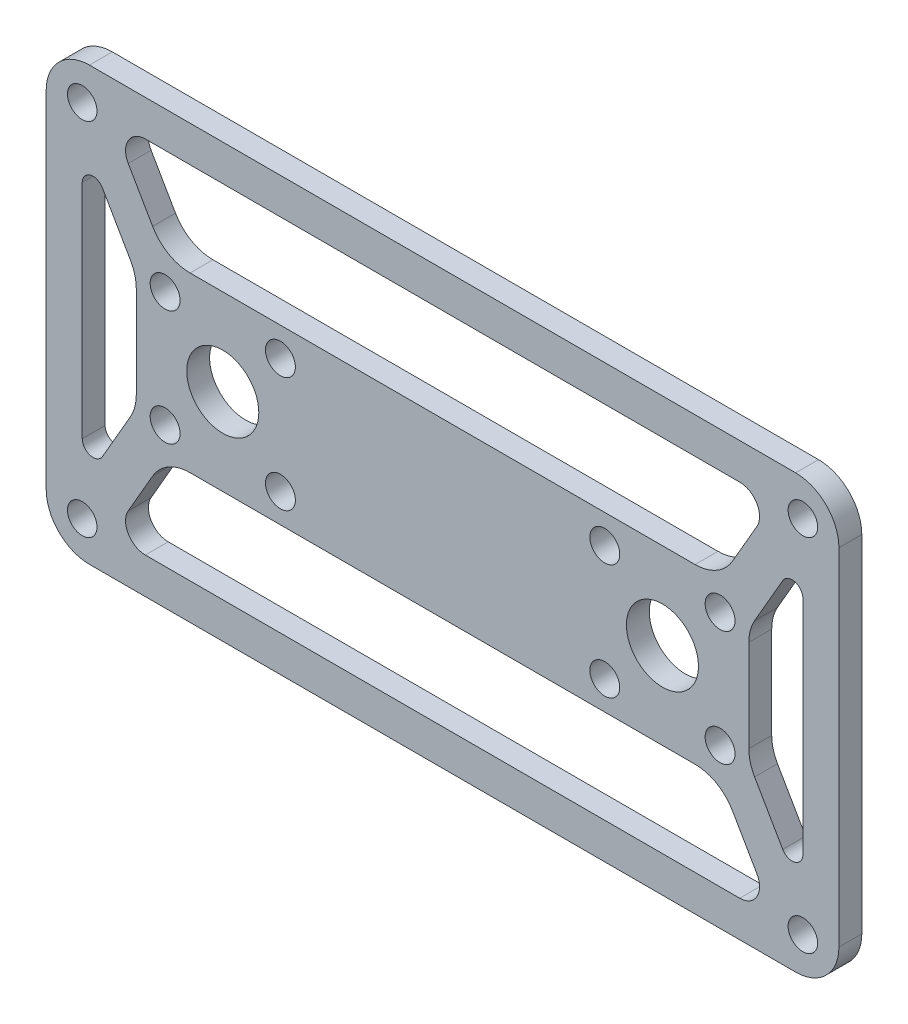
from build123d import *

# Parameters (mm, degrees)
SKETCH1_W           = 110
SKETCH1_H           = 60
SKETCH1_R           = 2.05
SKETCH1_R_2         = 2.075
SKETCH1_R_3         = 5
BOSS_EXTRUDE1_DEPTH = 3.175
FILLET1_R           = 6
FILLET2_R           = 2.75
FILLET3_R           = 1.5
FILLET4_R           = 6


with BuildPart() as part:
    # Sketch1 → Boss-Extrude1 (new body)
    with BuildSketch(Plane.XY):
        Rectangle(SKETCH1_W, SKETCH1_H)
        with Locations((-50, 25)):
            Circle(SKETCH1_R, mode=Mode.SUBTRACT)
        with Locations((50, 25)):
            Circle(SKETCH1_R, mode=Mode.SUBTRACT)
        with Locations((50, -25)):
            Circle(SKETCH1_R, mode=Mode.SUBTRACT)
        with Locations((-50, -25)):
            Circle(SKETCH1_R, mode=Mode.SUBTRACT)
        with Locations((-38.5, 8)):
            Circle(SKETCH1_R_2, mode=Mode.SUBTRACT)
        with Locations((-22.5, 8)):
            Circle(SKETCH1_R_2, mode=Mode.SUBTRACT)
        with Locations((-22.5, -8)):
            Circle(SKETCH1_R_2, mode=Mode.SUBTRACT)
        with Locations((-38.5, -8)):
            Circle(SKETCH1_R_2, mode=Mode.SUBTRACT)
        with Locations((22.51, 8)):
            Circle(SKETCH1_R_2, mode=Mode.SUBTRACT)
        with Locations((38.51, 8)):
            Circle(SKETCH1_R_2, mode=Mode.SUBTRACT)
        with Locations((38.51, -8)):
            Circle(SKETCH1_R_2, mode=Mode.SUBTRACT)
        with Locations((22.51, -8)):
            Circle(SKETCH1_R_2, mode=Mode.SUBTRACT)
        with Locations((-30.5, 0)):
            Circle(SKETCH1_R_3, mode=Mode.SUBTRACT)
        with Locations((30.51, 0)):
            Circle(SKETCH1_R_3, mode=Mode.SUBTRACT)
        Polygon((-50, 21), (-50, -21), (-42.5, -8), (-42.5, 8), align=None, mode=Mode.SUBTRACT)
        Polygon((-22.5, -12), (-38.5, -12), (-46, -25), (46, -25), (38.5, -12), (22.5, -12), align=None, mode=Mode.SUBTRACT)
        Polygon((-22.5, 12), (-38.5, 12), (-46, 25), (46, 25), (38.5, 12), (22.5, 12), align=None, mode=Mode.SUBTRACT)
        Polygon((42.5, -8), (42.5, 8), (50, 21), (50, -21), align=None, mode=Mode.SUBTRACT)
    extrude(amount=BOSS_EXTRUDE1_DEPTH)

    # Fillet1
    fillet1_edges = [part.edges().sort_by_distance(p)[0] for p in [
        (42.5, -8, 1.5875),
        (42.5, 8, 1.5875),
        (-42.5, 8, 1.5875),
        (-42.5, -8, 1.5875),
        (-38.5, -12, 1.5875),
        (38.5, -12, 1.5875),
        (38.5, 12, 1.5875),
        (-38.5, 12, 1.5875),
    ]]
    fillet(fillet1_edges, radius=FILLET1_R)

    # Fillet2
    fillet2_edges = [part.edges().sort_by_distance(p)[0] for p in [
        (-46, -25, 1.5875),
        (46, -25, 1.5875),
        (46, 25, 1.5875),
        (-46, 25, 1.5875),
    ]]
    fillet(fillet2_edges, radius=FILLET2_R)

    # Fillet3
    fillet3_edges = [part.edges().sort_by_distance(p)[0] for p in [
        (50, -21, 1.5875),
        (50, 21, 1.5875),
        (-50, 21, 1.5875),
        (-50, -21, 1.5875),
    ]]
    fillet(fillet3_edges, radius=FILLET3_R)

    # Fillet4
    fillet4_edges = [part.edges().sort_by_distance(p)[0] for p in [
        (-55, 30, 1.5875),
        (55, 30, 1.5875),
        (55, -30, 1.5875),
        (-55, -30, 1.5875),
    ]]
    fillet(fillet4_edges, radius=FILLET4_R)


solid = part.part
